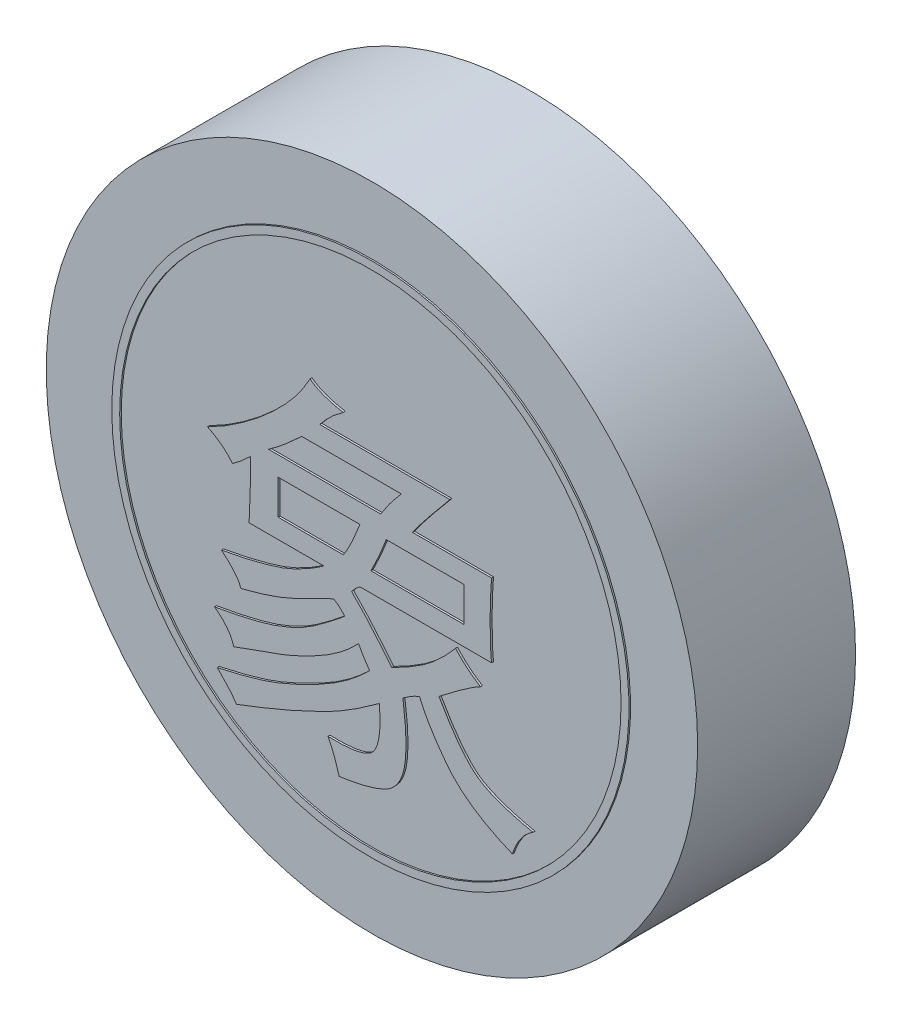
from build123d import *

# Parameters (mm, degrees)
SKETCH_1_R               = 16.5
DIAMETER33_HEIGHT8_DEPTH = 8
CHARACTER_DEPTH          = 0.1
SKETCH_3_R               = 13.1
SKETCH_3_R_2             = 12.7
INK_RING_DEPTH           = 0.08


with BuildPart() as part:
    # 草图1 → Diameter33_Height8 (new body)
    with BuildSketch(Plane.XY):
        Circle(SKETCH_1_R)
    extrude(amount=-DIAMETER33_HEIGHT8_DEPTH)

    # 草图2 → Character_象 (add)
    with BuildSketch(Plane.XY):
        with BuildLine():
            add(Edge.make_bspline(
                [(-0.929824561, -1.903508772), (-0.828743166, -2.004305693), (-0.635654735, -2.196850711), (-0.367903893, -2.481889137), (-0.12888562, -2.742919032), (0.088565858, -2.993303237), (0.304738016, -3.253167706), (0.548069364, -3.536422638), (0.813868216, -3.86678204), (1.004480711, -4.097376274), (1.105263158, -4.219298246)],
                knots=[0, 0, 0, 0, 1.110570339, 2.121441658, 3.042347323, 3.864152732, 4.701322879, 5.672279288, 6.769265416, 8, 8, 8, 8], degree=3))
            add(Edge.make_bspline(
                [(1.105263158, -4.219298246), (1.263308951, -4.137710103), (1.570224915, -3.979270558), (2.011035586, -3.736783677), (2.412727785, -3.487723983), (2.795695198, -3.24013725), (3.166100989, -2.953776542), (3.544692025, -2.615976785), (3.936594798, -2.212129154), (4.196832054, -1.917630288), (4.333333333, -1.763157895)],
                knots=[0, 0, 0, 0, 1.043545067, 2.026505312, 2.950571977, 3.816170627, 4.700665882, 5.694331323, 6.790616194, 8, 8, 8, 8], degree=3))
            add(Edge.make_bspline(
                [(4.333333333, -1.763157895), (4.42790443, -1.865267048), (4.616739779, -2.069154054), (4.926361469, -2.344080436), (5.249755107, -2.598635688), (5.480734886, -2.74329363), (5.596491228, -2.815789474)],
                knots=[0, 0, 0, 0, 1.011439186, 2.01959667, 3.007513797, 4, 4, 4, 4], degree=3))
            add(Edge.make_bspline(
                [(5.596491228, -2.815789474), (5.544137443, -2.842857439), (5.4268187, -2.903513602), (5.242508625, -3.019881513), (5.024551415, -3.159977335), (4.779416207, -3.333767264), (4.498420972, -3.529289787), (4.188699149, -3.755864532), (3.851873066, -4.015150294), (3.615212847, -4.195165085), (3.49122807, -4.289473684)],
                knots=[0, 0, 0, 0, 0.549629301, 1.231655349, 2.032014221, 2.967000527, 4.034417747, 5.225908916, 6.546671411, 8, 8, 8, 8], degree=3))
            add(Edge.make_bspline(
                [(3.49122807, -4.289473684), (3.588000347, -4.457355531), (3.774212015, -4.780398036), (4.06003518, -5.234255032), (4.334494295, -5.641493282), (4.602394398, -5.999061028), (4.862037369, -6.308651957), (5.11031353, -6.573598651), (5.351477806, -6.788776456), (5.592415125, -6.959432108), (5.842605156, -7.099520305), (6.111453286, -7.228983899), (6.405140072, -7.353950773), (6.725440224, -7.470417875), (7.072652245, -7.5793096), (7.445742268, -7.681866018), (7.844701467, -7.782440517), (8.120830615, -7.839176967), (8.263157895, -7.868421053)],
                knots=[0, 0, 0, 0, 1.486202843, 2.85978918, 4.113129665, 5.252135739, 6.285069278, 7.211058629, 8.034996073, 8.759608627, 9.470935696, 10.231786858, 11.047645233, 11.91800264, 12.844850006, 13.838006363, 14.885627704, 16, 16, 16, 16], degree=3))
            add(Edge.make_bspline(
                [(8.263157895, -7.868421053), (8.206020036, -7.905389145), (8.089977106, -7.980468712), (7.929184397, -8.116179271), (7.780767929, -8.272730064), (7.646055706, -8.449532578), (7.516088949, -8.641819632), (7.404305757, -8.858684382), (7.299214682, -9.09269016), (7.240570791, -9.257612265), (7.210526316, -9.342105263)],
                knots=[0, 0, 0, 0, 0.882392205, 1.792075865, 2.722432891, 3.675867886, 4.673605813, 5.729677539, 6.836866955, 8, 8, 8, 8], degree=3))
            add(Edge.make_bspline(
                [(7.210526316, -9.342105263), (7.028513508, -9.266211584), (6.674438587, -9.118573354), (6.171719859, -8.867864212), (5.703171782, -8.614170137), (5.275236792, -8.341866936), (4.884914504, -8.06055426), (4.534294439, -7.763895988), (4.218668392, -7.459859643), (3.945252749, -7.139348591), (3.705320935, -6.815912929), (3.476257516, -6.504250126), (3.270431153, -6.197689208), (3.077821516, -5.901770903), (2.910470835, -5.609301836), (2.75646074, -5.327986995), (2.622026019, -5.053373888), (2.545999688, -4.870331828), (2.50877193, -4.780701754)],
                knots=[0, 0, 0, 0, 1.402005598, 2.727363134, 3.993048918, 5.189525805, 6.331940506, 7.411907485, 8.453221336, 9.444943128, 10.403636806, 11.316844739, 12.19519781, 13.029237124, 13.827081363, 14.59072091, 15.309919328, 16, 16, 16, 16], degree=3))
            add(Edge.make_bspline(
                [(2.50877193, -4.780701754), (2.44678808, -4.807449537), (2.314995297, -4.864321846), (2.113751629, -4.976839779), (1.894790194, -5.113704486), (1.745067828, -5.217551171), (1.666666667, -5.271929825)],
                knots=[0, 0, 0, 0, 0.828774227, 1.762176171, 2.828177836, 4, 4, 4, 4], degree=3))
            add(Edge.make_bspline(
                [(1.666666667, -5.271929825), (1.6882625, -5.436439302), (1.729920898, -5.753778344), (1.777254782, -6.214838325), (1.807566, -6.643928413), (1.828680049, -7.041698776), (1.826748323, -7.408462587), (1.817192924, -7.743570187), (1.784349637, -8.046146182), (1.742677864, -8.319635781), (1.678971869, -8.566173326), (1.601486451, -8.792064676), (1.505775788, -8.998315058), (1.390228621, -9.184757599), (1.257750812, -9.351567846), (1.107551929, -9.498963433), (0.940669648, -9.627630527), (0.752176213, -9.734440338), (0.543791689, -9.827288689), (0.31396618, -9.915989893), (0.060674025, -9.998581098), (-0.217571459, -10.072731846), (-0.518450691, -10.147275117), (-0.845381499, -10.208925663), (-1.19469197, -10.274185765), (-1.436479122, -10.307400379), (-1.561403509, -10.324561404)],
                knots=[0, 0, 0, 0, 1.649230934, 3.181369092, 4.606057711, 5.92503094, 7.139285108, 8.251032652, 9.255324516, 10.162831072, 10.998302206, 11.782679226, 12.533926344, 13.253250842, 13.957993629, 14.64612434, 15.340264104, 16.046321073, 16.793956285, 17.606385427, 18.494187721, 19.440577461, 20.468228072, 21.574458556, 22.746793299, 24, 24, 24, 24], degree=3))
            add(Edge.make_bspline(
                [(-1.561403509, -10.324561404), (-1.598378631, -10.196852294), (-1.671857895, -9.943060799), (-1.802157951, -9.569418455), (-1.953258682, -9.205797776), (-2.066331616, -8.969098834), (-2.122807018, -8.850877193)],
                knots=[0, 0, 0, 0, 1.010024267, 2.007183108, 3.004667778, 4, 4, 4, 4], degree=3))
            add(Edge.make_bspline(
                [(-2.122807018, -8.850877193), (-1.966869659, -8.855238357), (-1.67224315, -8.863478298), (-1.253809565, -8.848384695), (-0.88538314, -8.811002274), (-0.565123639, -8.752196228), (-0.293372988, -8.674565414), (-0.06956973, -8.573160897), (0.10888208, -8.450043127), (0.233070526, -8.292060231), (0.321108577, -8.113205604), (0.39495621, -7.911275203), (0.446817096, -7.679562792), (0.485565396, -7.420739837), (0.508828255, -7.134195927), (0.512186341, -6.819186367), (0.5020602, -6.475770691), (0.483397854, -6.237864099), (0.473684211, -6.114035088)],
                knots=[0, 0, 0, 0, 1.58471914, 2.994152737, 4.251101141, 5.343957484, 6.29925099, 7.114494205, 7.832878125, 8.477647425, 9.131190312, 9.852427002, 10.657387502, 11.53880839, 12.510349002, 13.575629989, 14.738129365, 16, 16, 16, 16], degree=3))
            add(Edge.make_bspline(
                [(0.473684211, -6.114035088), (0.347187426, -6.204122011), (0.100672391, -6.379682056), (-0.259624694, -6.636613384), (-0.608445705, -6.869485719), (-0.941052133, -7.085381948), (-1.257126872, -7.283913504), (-1.560315475, -7.459639019), (-1.84439206, -7.62254617), (-2.378821322, -7.896324739), (-3.170280863, -8.27191044), (-4.056917556, -8.677340052), (-4.796894435, -8.988172781), (-5.40245326, -9.236084417), (-6.059649245, -9.497940279), (-6.517639841, -9.672779424), (-6.754385965, -9.763157895)],
                knots=[0, 0, 0, 0, 0.802634635, 1.564162327, 2.28693694, 2.970022653, 3.613619897, 4.215691619, 4.781081017, 5.305786877, 7.318484086, 9.308460638, 10.343841297, 11.466371935, 12.690307994, 14, 14, 14, 14], degree=3))
            add(Edge.make_bspline(
                [(-6.754385965, -9.763157895), (-6.808823097, -9.686144779), (-6.928980908, -9.516155528), (-7.151382439, -9.254577297), (-7.423646659, -8.95644167), (-7.627730051, -8.750471622), (-7.736842105, -8.640350877)],
                knots=[0, 0, 0, 0, 0.757198483, 1.671346525, 2.754998321, 4, 4, 4, 4], degree=3))
            add(Edge.make_bspline(
                [(-7.736842105, -8.640350877), (-7.519124707, -8.592957982), (-7.09382113, -8.500377564), (-6.473677177, -8.34554628), (-5.883610448, -8.186126947), (-5.408946683, -8.040118666), (-5.032118, -7.914743296), (-4.738483602, -7.804962586), (-4.430340787, -7.68013717), (-4.108065065, -7.542200968), (-3.771569852, -7.391178338), (-3.421953424, -7.224724354), (-3.056977538, -7.044894705), (-2.555348804, -6.788438549), (-1.939573575, -6.441599315), (-1.24350185, -5.978426785), (-0.600493767, -5.474729191), (-0.21057341, -5.104389031), (-0.01754386, -4.921052632)],
                knots=[0, 0, 0, 0, 1.231346762, 2.405394272, 3.532091312, 4.608932932, 5.149473193, 5.726685741, 6.341068464, 6.986744666, 7.66396097, 8.379304989, 9.126623402, 9.91251923, 11.49284938, 13.029304255, 14.529361054, 16, 16, 16, 16], degree=3))
            add(Edge.make_bspline(
                [(-0.01754386, -4.921052632), (-0.073600096, -4.840887334), (-0.182134735, -4.685673353), (-0.330334372, -4.452797679), (-0.464455543, -4.230409008), (-0.541584644, -4.081099932), (-0.578947368, -4.00877193)],
                knots=[0, 0, 0, 0, 1.09470491, 2.1195394, 3.089071053, 4, 4, 4, 4], degree=3))
            add(Edge.make_bspline(
                [(-0.578947368, -4.00877193), (-0.714328109, -4.14816026), (-0.989907684, -4.431897642), (-1.458561813, -4.820004052), (-1.97905234, -5.184676554), (-2.539706302, -5.524155532), (-3.117016894, -5.82784172), (-3.679463968, -6.105854271), (-4.222687922, -6.34066729), (-4.927567318, -6.599523085), (-5.819165164, -6.906907671), (-6.529671823, -7.171214304), (-6.894736842, -7.307017544)],
                knots=[0, 0, 0, 0, 0.809267059, 1.647335296, 2.530801539, 3.455846417, 4.376477467, 5.248389781, 6.069933452, 6.841097681, 8.376926212, 10, 10, 10, 10], degree=3))
            add(Edge.make_bspline(
                [(-6.894736842, -7.307017544), (-6.937076913, -7.190505473), (-7.023636666, -6.952308989), (-7.243969076, -6.62521988), (-7.527262626, -6.314260434), (-7.757158667, -6.136613457), (-7.877192982, -6.043859649)],
                knots=[0, 0, 0, 0, 0.910856203, 1.862148215, 2.88377558, 4, 4, 4, 4], degree=3))
            add(Edge.make_bspline(
                [(-7.877192982, -6.043859649), (-7.712536052, -6.01467887), (-7.392450383, -5.957952748), (-6.927597399, -5.87088588), (-6.493072331, -5.778650696), (-6.087814341, -5.689427197), (-5.713001525, -5.594970728), (-5.367237322, -5.501532774), (-5.050094763, -5.409616914), (-4.672705808, -5.281802065), (-4.238196769, -5.113551788), (-3.750865455, -4.896920945), (-3.304167742, -4.660254), (-2.89242272, -4.400235119), (-2.498719456, -4.117281629), (-2.098405863, -3.822095327), (-1.6894032, -3.505028667), (-1.418705944, -3.280919685), (-1.280701754, -3.166666667)],
                knots=[0, 0, 0, 0, 1.096863902, 2.132254105, 3.101883048, 4.010422, 4.853915215, 5.636911916, 6.359754767, 7.019266169, 8.249777128, 9.414730366, 10.515502993, 11.562415892, 12.606177758, 13.695004187, 14.824889902, 16, 16, 16, 16], degree=3))
            add(Edge.make_bspline(
                [(-1.280701754, -3.166666667), (-1.317986132, -3.120872439), (-1.393589166, -3.028013641), (-1.525542811, -2.899471003), (-1.675536629, -2.780417155), (-1.785965472, -2.710820254), (-1.842105263, -2.675438596)],
                knots=[0, 0, 0, 0, 0.943775431, 1.913731418, 2.939383241, 4, 4, 4, 4], degree=3))
            add(Edge.make_bspline(
                [(-1.842105263, -2.675438596), (-2.172052985, -2.839460266), (-2.837519636, -3.170273132), (-3.59200137, -3.540548178), (-4.113060006, -3.784596457), (-4.398911163, -3.902662952), (-4.704347865, -4.021049645), (-5.032059134, -4.133475981), (-5.379320415, -4.249580933), (-5.749668894, -4.356574177), (-6.138951141, -4.467129505), (-6.406801125, -4.535295155), (-6.543859649, -4.570175439)],
                knots=[0, 0, 0, 0, 2.174054055, 4.384817278, 4.958909761, 5.568392443, 6.209182902, 6.891410063, 7.612371255, 8.369329936, 9.165588032, 10, 10, 10, 10], degree=3))
            add(Edge.make_bspline(
                [(-6.543859649, -4.570175439), (-6.558399765, -4.527287082), (-6.588884819, -4.437366626), (-6.658814164, -4.304781058), (-6.748294372, -4.165633707), (-6.861215707, -4.020264054), (-6.996086984, -3.867810535), (-7.153538896, -3.709576582), (-7.329621341, -3.542121616), (-7.458972676, -3.433660299), (-7.526315789, -3.377192982)],
                knots=[0, 0, 0, 0, 0.693681639, 1.454384706, 2.291140141, 3.229370599, 4.274444009, 5.41144842, 6.65234386, 8, 8, 8, 8], degree=3))
            add(Edge.make_bspline(
                [(-7.526315789, -3.377192982), (-7.266181713, -3.329012843), (-6.761095832, -3.235464515), (-6.03180552, -3.079968737), (-5.356809135, -2.902795901), (-4.721294272, -2.720358049), (-4.110945647, -2.498010628), (-3.515248063, -2.211794386), (-2.914970623, -1.879289851), (-2.529741552, -1.616459588), (-2.333333333, -1.48245614)],
                knots=[0, 0, 0, 0, 1.137772307, 2.209140512, 3.205919273, 4.138448836, 5.052058767, 5.995422594, 6.977970497, 8, 8, 8, 8], degree=3))
            Line((-2.333333333, -1.48245614), (-6.122807018, -1.48245614))
            add(Edge.make_bspline(
                [(-6.122807018, -1.48245614), (-6.117601194, -1.390623471), (-6.106650964, -1.197457336), (-6.089678174, -0.895212635), (-6.081359739, -0.565834633), (-6.069816218, -0.210685101), (-6.062260237, 0.171408515), (-6.058144424, 0.579490388), (-6.051119302, 1.013517411), (-6.052117823, 1.311562846), (-6.052631579, 1.464912281)],
                knots=[0, 0, 0, 0, 0.748661925, 1.574778685, 2.463722955, 3.43019847, 4.466993754, 5.574178629, 6.751873734, 8, 8, 8, 8], degree=3))
            add(Edge.make_bspline(
                [(-6.052631579, 1.464912281), (-6.196500302, 1.327617019), (-6.485194855, 1.052113118), (-6.804653439, 0.812956968), (-6.964912281, 0.692982456)],
                knots=[0, 0, 0, 0, 0.996684702, 2, 2, 2, 2], degree=3))
            add(Edge.make_bspline(
                [(-6.964912281, 0.692982456), (-7.041285503, 0.786286313), (-7.199047549, 0.979021501), (-7.494133322, 1.232817643), (-7.838433335, 1.470604086), (-8.094778716, 1.605366447), (-8.228070175, 1.675438596)],
                knots=[0, 0, 0, 0, 0.894966504, 1.848707456, 2.881396178, 4, 4, 4, 4], degree=3))
            add(Edge.make_bspline(
                [(-8.228070175, 1.675438596), (-7.970288316, 1.811101669), (-7.446538837, 2.086735742), (-6.689930721, 2.578940325), (-5.935992941, 3.126722959), (-5.32776663, 3.634701005), (-4.856057561, 4.063495675), (-4.523540312, 4.389986854), (-4.216717349, 4.719375239), (-3.929239673, 5.045344412), (-3.669456935, 5.37545267), (-3.435054904, 5.707765533), (-3.22022989, 6.038154703), (-3.096088363, 6.265486648), (-3.035087719, 6.377192982)],
                knots=[0, 0, 0, 0, 1.47592763, 2.998722752, 4.570191903, 6.198038662, 7.012500948, 7.801291712, 8.559411387, 9.293963217, 10.00385317, 10.687445814, 11.355037339, 12, 12, 12, 12], degree=3))
            add(Edge.make_bspline(
                [(-3.035087719, 6.377192982), (-2.991563612, 6.342490813), (-2.900252438, 6.269687578), (-2.743094117, 6.174267986), (-2.562916618, 6.087278077), (-2.362843209, 6.003707193), (-2.141262704, 5.928811354), (-1.897982984, 5.8618445), (-1.632700399, 5.799267987), (-1.447194051, 5.763950992), (-1.350877193, 5.745614035)],
                knots=[0, 0, 0, 0, 0.734457435, 1.540851154, 2.420812151, 3.374703154, 4.402108324, 5.506789767, 6.705498883, 8, 8, 8, 8], degree=3))
            add(Edge.make_bspline(
                [(-1.350877193, 5.745614035), (-1.464675277, 5.66222105), (-1.689471919, 5.497486617), (-2.003144847, 5.226418298), (-2.287165974, 4.934153545), (-2.458591155, 4.726230094), (-2.543859649, 4.622807018)],
                knots=[0, 0, 0, 0, 1.029479124, 2.033632219, 3.0219102, 4, 4, 4, 4], degree=3))
            Line((-2.543859649, 4.622807018), (4.052631579, 4.622807018))
            add(Edge.make_bspline(
                [(4.052631579, 4.622807018), (3.935712871, 4.482423282), (3.712097761, 4.213929685), (3.391297808, 3.830024312), (3.105550795, 3.478292749), (2.851177725, 3.162478258), (2.630212862, 2.881782307), (2.441907458, 2.637440654), (2.287805879, 2.426710097), (2.198336721, 2.295948955), (2.157894737, 2.236842105)],
                knots=[0, 0, 0, 0, 1.438623262, 2.751466418, 3.939472877, 5.007039666, 5.944651069, 6.752429781, 7.436071417, 8, 8, 8, 8], degree=3))
            Line((2.157894737, 2.236842105), (6.157894737, 2.236842105))
            add(Edge.make_bspline(
                [(6.157894737, 2.236842105), (6.146543755, 2.109551335), (6.122094831, 1.835379231), (6.104113144, 1.392269721), (6.090689128, 0.887999847), (6.088746862, 0.530985253), (6.087719298, 0.342105263)],
                knots=[0, 0, 0, 0, 0.808434884, 1.741291153, 2.805021106, 4, 4, 4, 4], degree=3))
            add(Edge.make_bspline(
                [(6.087719298, 0.342105263), (6.088720132, 0.15495633), (6.090596965, -0.195998191), (6.104038444, -0.687266239), (6.121494301, -1.108798242), (6.146508014, -1.365569105), (6.157894737, -1.48245614)],
                knots=[0, 0, 0, 0, 1.229412054, 2.305477845, 3.22862092, 4, 4, 4, 4], degree=3))
            Line((6.157894737, -1.48245614), (-0.50877193, -1.48245614))
            add(Edge.make_bspline(
                [(-0.50877193, -1.48245614), (-0.593534936, -1.549349281), (-0.750542692, -1.673256425), (-0.873327147, -1.83094894), (-0.929824561, -1.903508772)],
                knots=[0, 0, 0, 0, 1.07973018, 2, 2, 2, 2], degree=3))
        make_face()
        with BuildLine():
            Line((4.754385965, -0.5), (4.754385965, 1.254385965))
            Line((4.754385965, 1.254385965), (0.824561404, 1.254385965))
            add(Edge.make_bspline(
                [(0.824561404, 1.254385965), (0.774405822, 1.120586442), (0.670418432, 0.843180366), (0.488876169, 0.418033966), (0.280855152, -0.032659721), (0.130338921, -0.340876338), (0.052631579, -0.5)],
                knots=[0, 0, 0, 0, 0.894064617, 1.853661004, 2.891904906, 4, 4, 4, 4], degree=3))
            Line((0.052631579, -0.5), (4.754385965, -0.5))
        make_face(mode=Mode.SUBTRACT)
        with BuildLine():
            add(Edge.make_bspline(
                [(0.543859649, 2.236842105), (0.617150512, 2.354600399), (0.766290706, 2.594227746), (1.017408237, 2.945406394), (1.295469119, 3.295569029), (1.495062077, 3.524176918), (1.596491228, 3.640350877)],
                knots=[0, 0, 0, 0, 0.947173216, 1.927410771, 2.946751592, 4, 4, 4, 4], degree=3))
            Line((1.596491228, 3.640350877), (-3.456140351, 3.640350877))
            add(Edge.make_bspline(
                [(-3.456140351, 3.640350877), (-3.5418, 3.561392945), (-3.707290734, 3.408849637), (-3.949966343, 3.188754836), (-4.180392152, 2.987822598), (-4.396117804, 2.801159723), (-4.601115829, 2.63642379), (-4.791908057, 2.486474798), (-4.969613405, 2.354752635), (-5.085567192, 2.274675472), (-5.140350877, 2.236842105)],
                knots=[0, 0, 0, 0, 1.27415176, 2.461606039, 3.582951637, 4.617898728, 5.581273312, 6.458861859, 7.271871757, 8, 8, 8, 8], degree=3))
            Line((-5.140350877, 2.236842105), (0.543859649, 2.236842105))
        make_face(mode=Mode.SUBTRACT)
        with BuildLine():
            add(Edge.make_bspline(
                [(-1.350877193, -0.5), (-1.319983381, -0.455316869), (-1.254179354, -0.3601415), (-1.161146297, -0.199535288), (-1.06396273, -0.015828556), (-0.958318152, 0.190083307), (-0.852763183, 0.42242167), (-0.742325976, 0.678585471), (-0.623525939, 0.957358099), (-0.548026651, 1.152779528), (-0.50877193, 1.254385965)],
                knots=[0, 0, 0, 0, 0.668327248, 1.423541546, 2.282165783, 3.226300311, 4.271090304, 5.421920148, 6.659566098, 8, 8, 8, 8], degree=3))
            Line((-0.50877193, 1.254385965), (-4.649122807, 1.254385965))
            Line((-4.649122807, 1.254385965), (-4.649122807, -0.5))
            Line((-4.649122807, -0.5), (-1.350877193, -0.5))
        make_face(mode=Mode.SUBTRACT)
    extrude(amount=CHARACTER_DEPTH)

    # 草图3 → Ink_ring (add)
    with BuildSketch(Plane.XY):
        with Locations(Location((0, 0, 0), (0, 0, 180))):
            Circle(SKETCH_3_R)
        with Locations(Location((0, 0, 0), (0, 0, 180))):
            Circle(SKETCH_3_R_2, mode=Mode.SUBTRACT)
    extrude(amount=INK_RING_DEPTH)


solid = part.part
